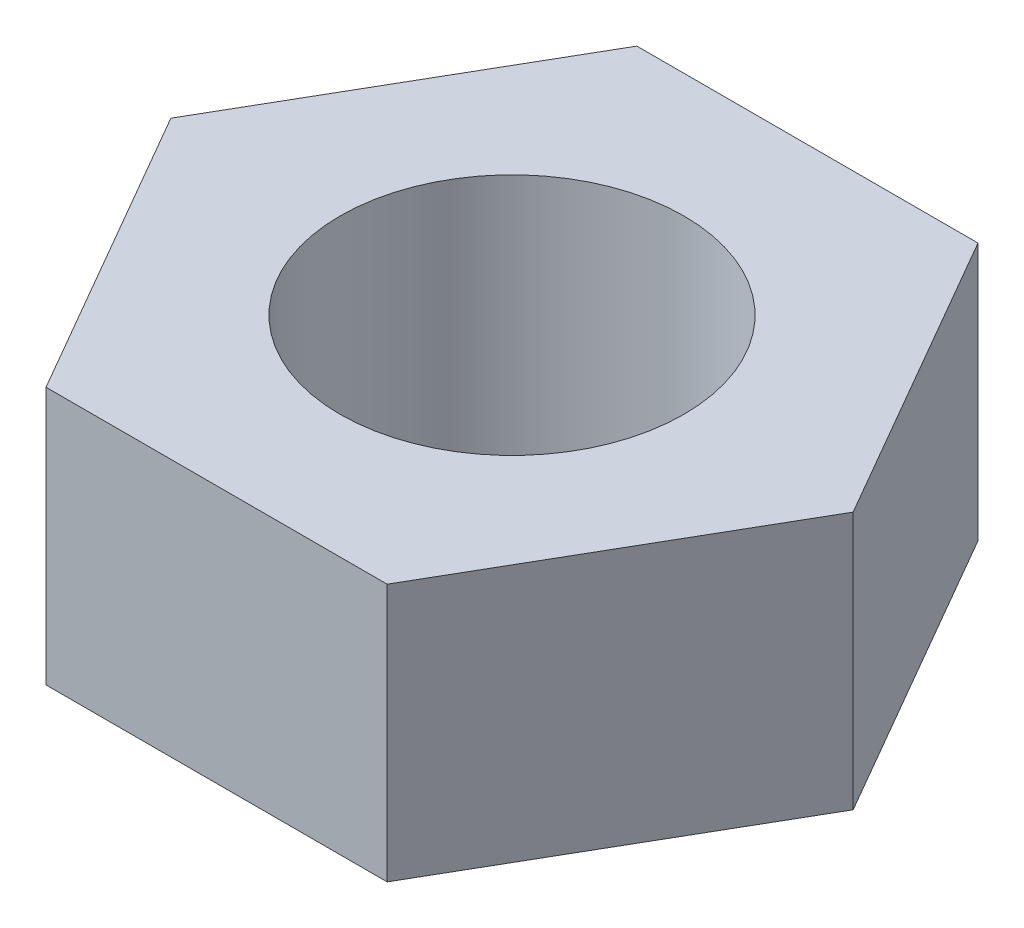
from build123d import *

# Parameters (mm, degrees)
BASE_OUTLINE_SKETCH_R = 1.6
BASE_OUTLINE_DEPTH    = 2.4


with BuildPart() as part:
    # Base Outline Sketch → Base Outline (new body)
    with BuildSketch(Plane(origin=(0, -159.9, 0), x_dir=(1, 0, 0), z_dir=(0, 1, 0))):
        Polygon((-53.116224765, -50), (-54.703938006, -52.75), (-57.879364486, -52.75), (-59.467077727, -50), (-57.879364486, -47.25), (-54.703938006, -47.25), align=None)
        with Locations(Location((-56.291651246, -50, 0), (0, 0, 270))):
            Circle(BASE_OUTLINE_SKETCH_R, mode=Mode.SUBTRACT)
    extrude(amount=BASE_OUTLINE_DEPTH)


solid = part.part
